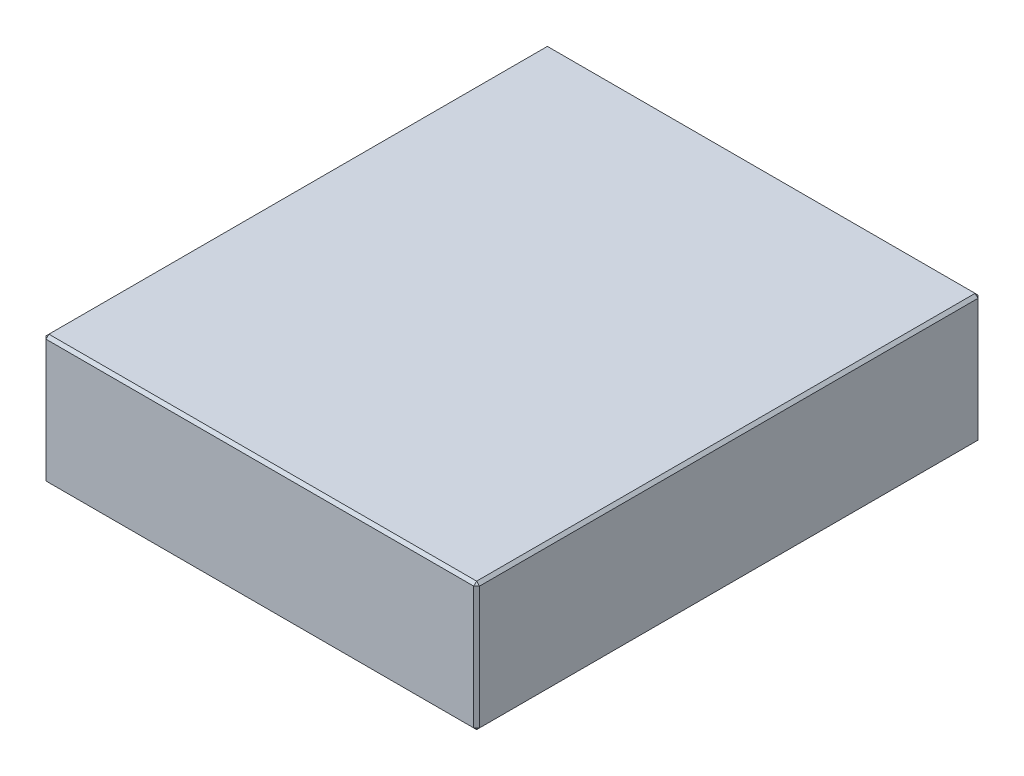
from build123d import *

# Parameters (mm, degrees)
SKICA1_W                = 30
SKICA1_H                = 8.9
P_IDAT_VYSUNUT_M1_DEPTH = 34.896
ZKOSEN_1_SIZE           = 0.2


with BuildPart() as part:
    # Skica1 → Přidat vysunutím1 (new body)
    with BuildSketch(Plane.XY):
        Rectangle(SKICA1_W, SKICA1_H)
    extrude(amount=P_IDAT_VYSUNUT_M1_DEPTH)

    # Zkosení1
    zkosen_1_edges = [part.edges().sort_by_distance(p)[0] for p in [
        (-15, 0, 34.896),
        (0, -4.45, 34.896),
        (15, 0, 34.896),
        (0, -4.45, 0),
        (-15, 0, 0),
        (0, 4.45, 0),
        (15, 0, 0),
        (15, -4.45, 17.448),
        (-15, -4.45, 17.448),
        (-15, 4.45, 17.448),
        (15, 4.45, 17.448),
        (0, 4.45, 34.896),
    ]]
    chamfer(zkosen_1_edges, length=ZKOSEN_1_SIZE)


solid = part.part
